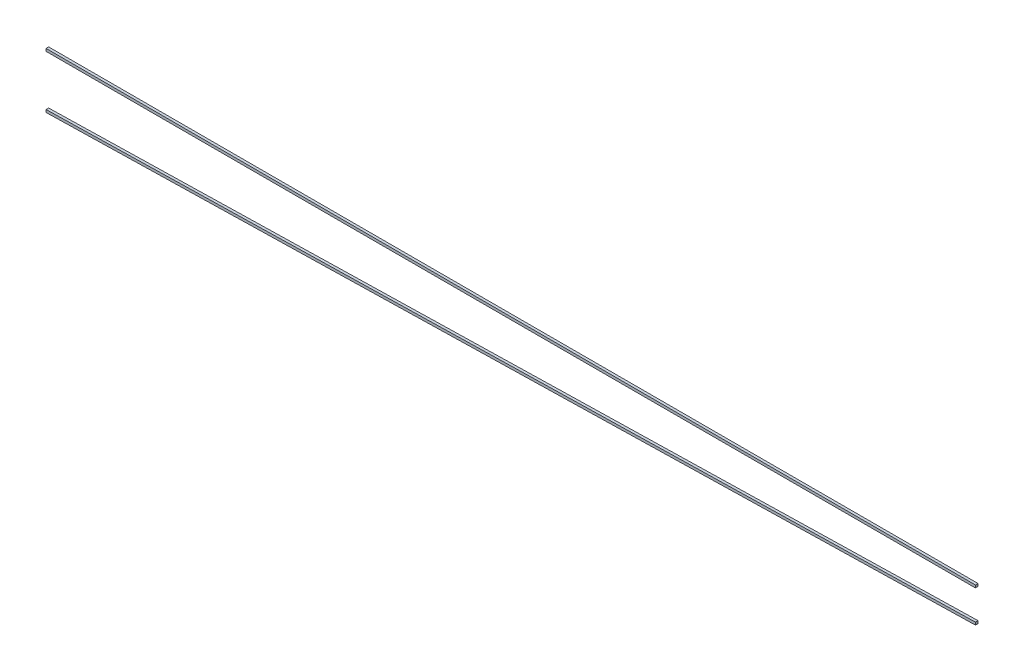
from build123d import *

# Parameters (mm, degrees)
EXTRUDE_1_DEPTH   = 2
EXTRUDE_1_2_DEPTH = 2


with BuildPart() as part:
    # Model → 凸台-拉伸1 (new body)
    with BuildSketch(Plane.XY):
        Polygon((607.645617518, 355.968593343), (643.420272899, 355.968593343), (745.335428769, 355.968593343), (890.239047675, 355.968593343), (1053.01641336, 355.968593343), (1216.574493693, 355.968593343), (1324.877179039, 355.968593343), (1324.877179039, 353.968593343), (607.645617518, 353.968593343), align=None)
    extrude(amount=EXTRUDE_1_DEPTH)


with BuildPart() as body_2:
    # Model → Extrude 1 2 (new body)
    with BuildSketch(Plane.XY):
        Polygon((607.645617518, 313.120827579), (643.420272899, 313.919448523), (745.335428769, 316.194566835), (890.239047675, 319.429344567), (1053.01641336, 323.063130046), (1216.574493693, 326.714343704), (1324.877179039, 329.132055156), (1324.877179039, 331.132055156), (607.600982724, 315.12032945), align=None)
    extrude(amount=EXTRUDE_1_2_DEPTH)


solid = Compound([part.part, body_2.part])
